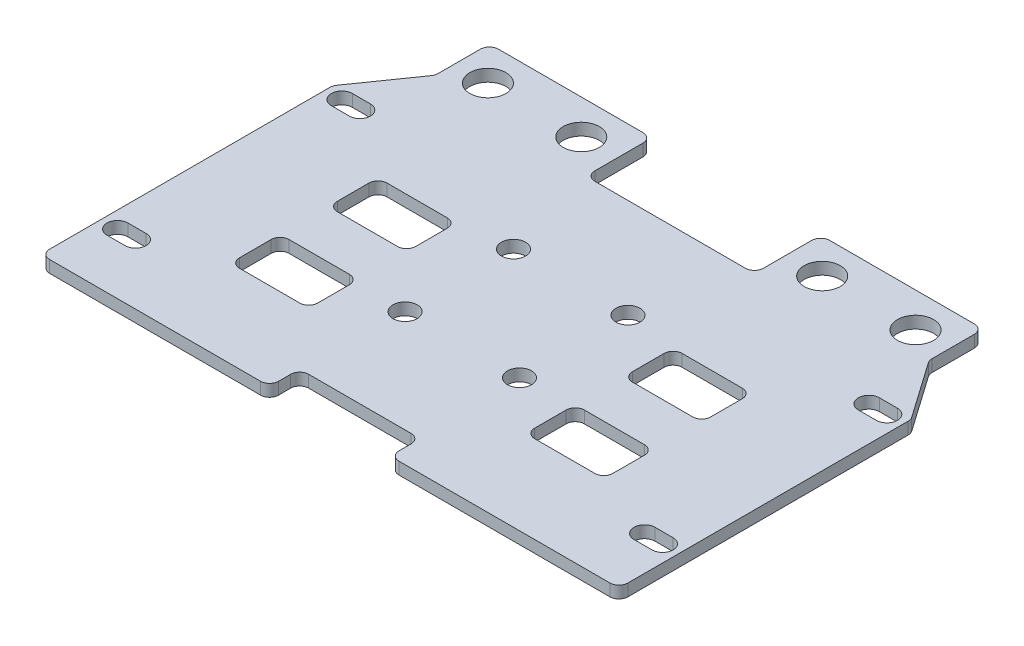
from build123d import *

# Parameters (mm, degrees)
SKETCH1_R           = 2
SKETCH1_R_2         = 3
SKETCH1_W           = 13
SKETCH1_H           = 8.25
BOSS_EXTRUDE1_DEPTH = 2
FILLET1_R           = 1.5


with BuildPart() as part:
    # Sketch1 → Boss-Extrude1 (new body)
    with BuildSketch(Plane(origin=(0, 0, 0), x_dir=(1, 0, 0), z_dir=(0, 1, 0))):
        Polygon((38, 0), (38, 5), (58, 5), (58, 0), (96, 0), (96, 48.5), (89, 58.5), (89, 67.5), (62, 67.5), (62, 56.5), (34, 56.5), (34, 67.5), (7, 67.5), (7, 58.5), (0, 48.5), (0, 0), align=None)
        with Locations(Location((38.5, 40, 0), (0, 0, 270))):
            Circle(SKETCH1_R, mode=Mode.SUBTRACT)
        with Locations(Location((38.5, 22, 0), (0, 0, 270))):
            Circle(SKETCH1_R, mode=Mode.SUBTRACT)
        with Locations(Location((57.5, 22, 0), (0, 0, 90))):
            Circle(SKETCH1_R, mode=Mode.SUBTRACT)
        with Locations(Location((57.5, 40, 0), (0, 0, 90))):
            Circle(SKETCH1_R, mode=Mode.SUBTRACT)
        with Locations(Location((12.5, 61.75, 0), (0, 0, 270))):
            Circle(SKETCH1_R_2, mode=Mode.SUBTRACT)
        with Locations(Location((28, 61.75, 0), (0, 0, 270))):
            Circle(SKETCH1_R_2, mode=Mode.SUBTRACT)
        with Locations(Location((68, 61.75, 0), (0, 0, 90))):
            Circle(SKETCH1_R_2, mode=Mode.SUBTRACT)
        with Locations(Location((83.5, 61.75, 0), (0, 0, 90))):
            Circle(SKETCH1_R_2, mode=Mode.SUBTRACT)
        with Locations((72.5, 18.625)):
            Rectangle(SKETCH1_W, SKETCH1_H, mode=Mode.SUBTRACT)
        with Locations((23.5, 34.875)):
            Rectangle(SKETCH1_W, SKETCH1_H, mode=Mode.SUBTRACT)
        with Locations((23.5, 18.625)):
            Rectangle(SKETCH1_W, SKETCH1_H, mode=Mode.SUBTRACT)
        with Locations((72.5, 34.875)):
            Rectangle(SKETCH1_W, SKETCH1_H, mode=Mode.SUBTRACT)
        with BuildLine():
            Line((2.75, 11.75), (5.75, 11.75))
            ThreePointArc((5.75, 11.75), (7.5, 10), (5.75, 8.25))
            Line((5.75, 8.25), (2.75, 8.25))
            ThreePointArc((2.75, 8.25), (1, 10), (2.75, 11.75))
        make_face(mode=Mode.SUBTRACT)
        with BuildLine():
            Line((93.25, 8.25), (90.25, 8.25))
            ThreePointArc((90.25, 8.25), (88.5, 10), (90.25, 11.75))
            Line((90.25, 11.75), (93.25, 11.75))
            ThreePointArc((93.25, 11.75), (95, 10), (93.25, 8.25))
        make_face(mode=Mode.SUBTRACT)
        with BuildLine():
            Line((93.25, 45.5), (90.25, 45.5))
            ThreePointArc((90.25, 45.5), (88.5, 47.25), (90.25, 49))
            Line((90.25, 49), (93.25, 49))
            ThreePointArc((93.25, 49), (95, 47.25), (93.25, 45.5))
        make_face(mode=Mode.SUBTRACT)
        with BuildLine():
            Line((2.75, 49), (5.75, 49))
            ThreePointArc((5.75, 49), (7.5, 47.25), (5.75, 45.5))
            Line((5.75, 45.5), (2.75, 45.5))
            ThreePointArc((2.75, 45.5), (1, 47.25), (2.75, 49))
        make_face(mode=Mode.SUBTRACT)
    extrude(amount=BOSS_EXTRUDE1_DEPTH)

    # Fillet1
    fillet1_edges = [part.edges().sort_by_distance(p)[0] for p in [
        (0, 1, -48.5),
        (7, 1, -58.5),
        (7, 1, -67.5),
        (34, 1, -67.5),
        (34, 1, -56.5),
        (62, 1, -56.5),
        (62, 1, -67.5),
        (89, 1, -67.5),
        (89, 1, -58.5),
        (96, 1, -48.5),
        (96, 1, 0),
        (58, 1, 0),
        (58, 1, -5),
        (38, 1, -5),
        (38, 1, 0),
        (0, 1, 0),
        (17, 1, -39),
        (17, 1, -30.75),
        (30, 1, -30.75),
        (30, 1, -39),
        (17, 1, -22.75),
        (17, 1, -14.5),
        (30, 1, -14.5),
        (30, 1, -22.75),
        (79, 1, -14.5),
        (79, 1, -22.75),
        (66, 1, -22.75),
        (66, 1, -14.5),
        (79, 1, -30.75),
        (79, 1, -39),
        (66, 1, -39),
        (66, 1, -30.75),
    ]]
    fillet(fillet1_edges, radius=FILLET1_R)


solid = part.part
